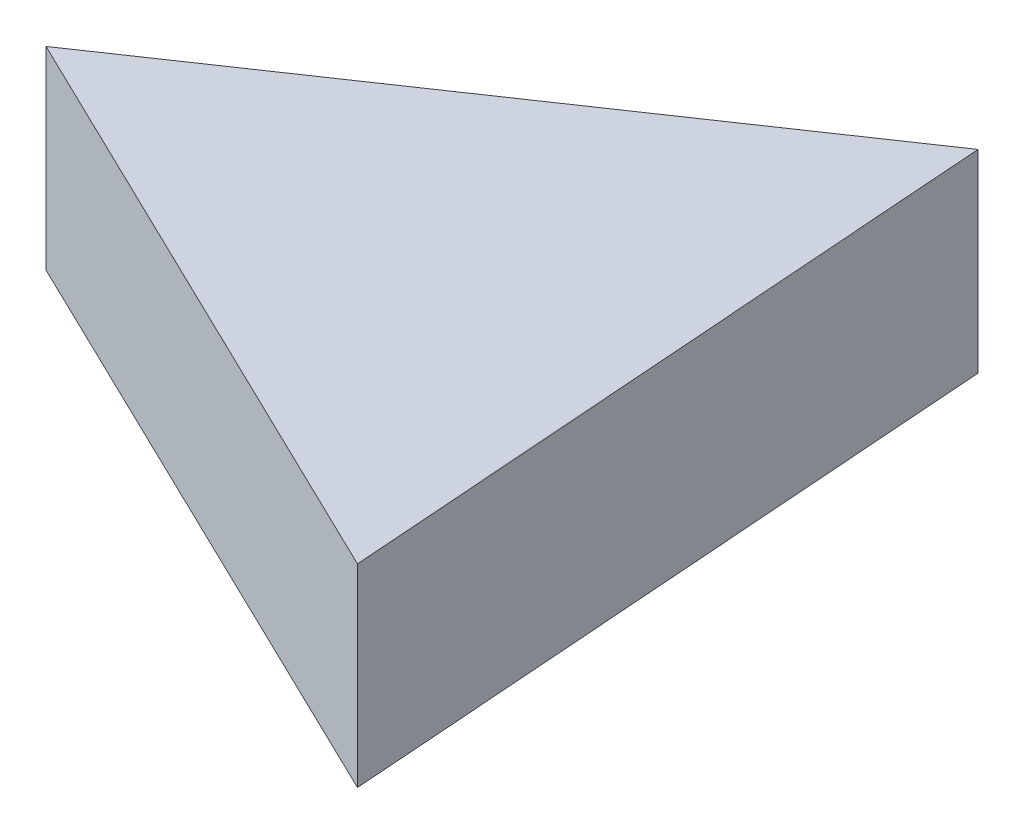
from build123d import *

# Parameters (mm, degrees)
BOSS_EXTRUDE1_DEPTH = 10


with BuildPart() as part:
    # Sketch1 → Boss-Extrude1 (new body)
    with BuildSketch(Plane(origin=(0, 0, 0), x_dir=(1, 0, 0), z_dir=(0, 1, 0))):
        Polygon((11.231045296, -16.548825383), (8.716180537, 18.000783229), (-19.947225833, -1.451957845), align=None)
    extrude(amount=-BOSS_EXTRUDE1_DEPTH)


solid = part.part
